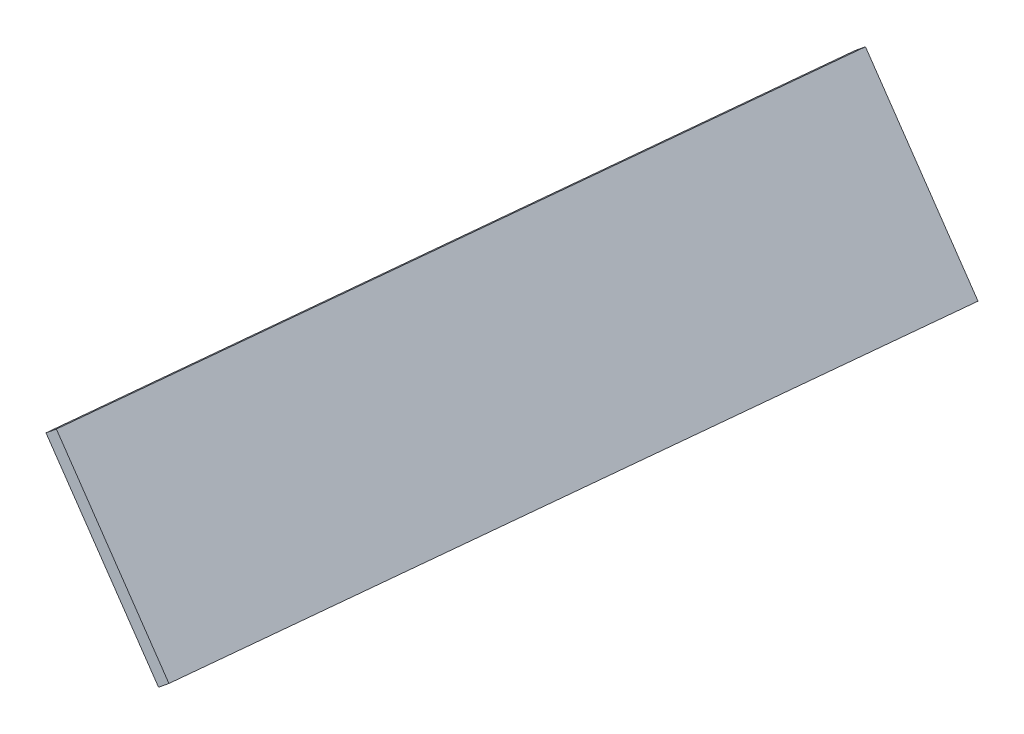
from build123d import *

# Parameters (mm, degrees)
SKETCH2_W           = 98.149545762
SKETCH2_H           = 26.137581918
BOSS_EXTRUDE1_DEPTH = 2


with BuildPart() as part:
    # Sketch2 → Boss-Extrude1 (new body)
    with BuildSketch(Plane(origin=(50.127956242, 41.763636598, 5.00398956), x_dir=(0.09933064530874071, 0, -0.9950544823790048), z_dir=(0.766044443118977, 0.6382227431293148, 0.07646987196948322))):
        with Locations((0, -41.180142207)):
            Rectangle(SKETCH2_W, SKETCH2_H)
    extrude(amount=BOSS_EXTRUDE1_DEPTH)


solid = part.part
